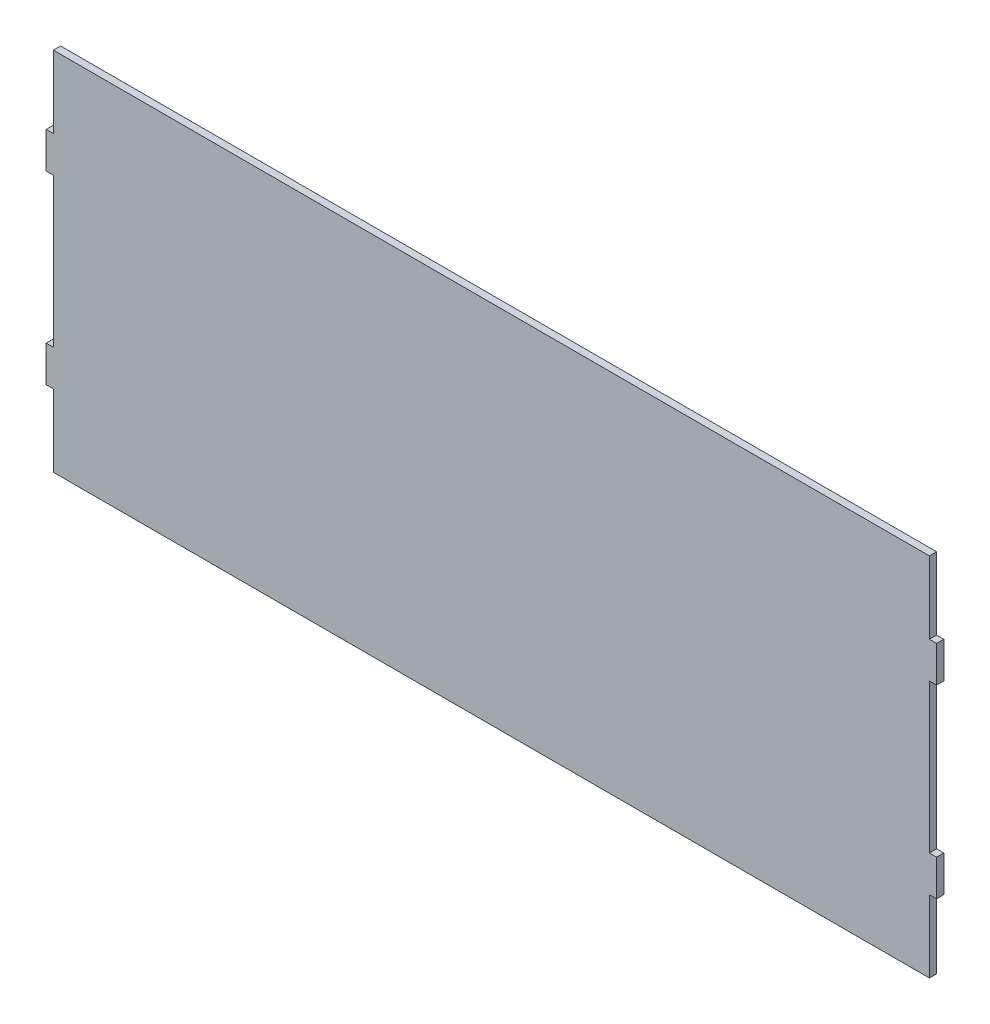
from build123d import *

# Parameters (mm, degrees)
BOSS_EXTRUDE1_DEPTH = 3


with BuildPart() as part:
    # Sketch1 → Boss-Extrude1 (new body)
    with BuildSketch(Plane.XY):
        Polygon((0, 0), (364, 0), (364, 30), (367, 30), (367, 45), (364, 45), (364, 106.91), (367, 106.91), (367, 121.91), (364, 121.91), (364, 151.91), (0, 151.91), (0, 121.91), (-3, 121.91), (-3, 106.91), (0, 106.91), (0, 45), (-3, 45), (-3, 30), (0, 30), align=None)
    extrude(amount=BOSS_EXTRUDE1_DEPTH)


solid = part.part
